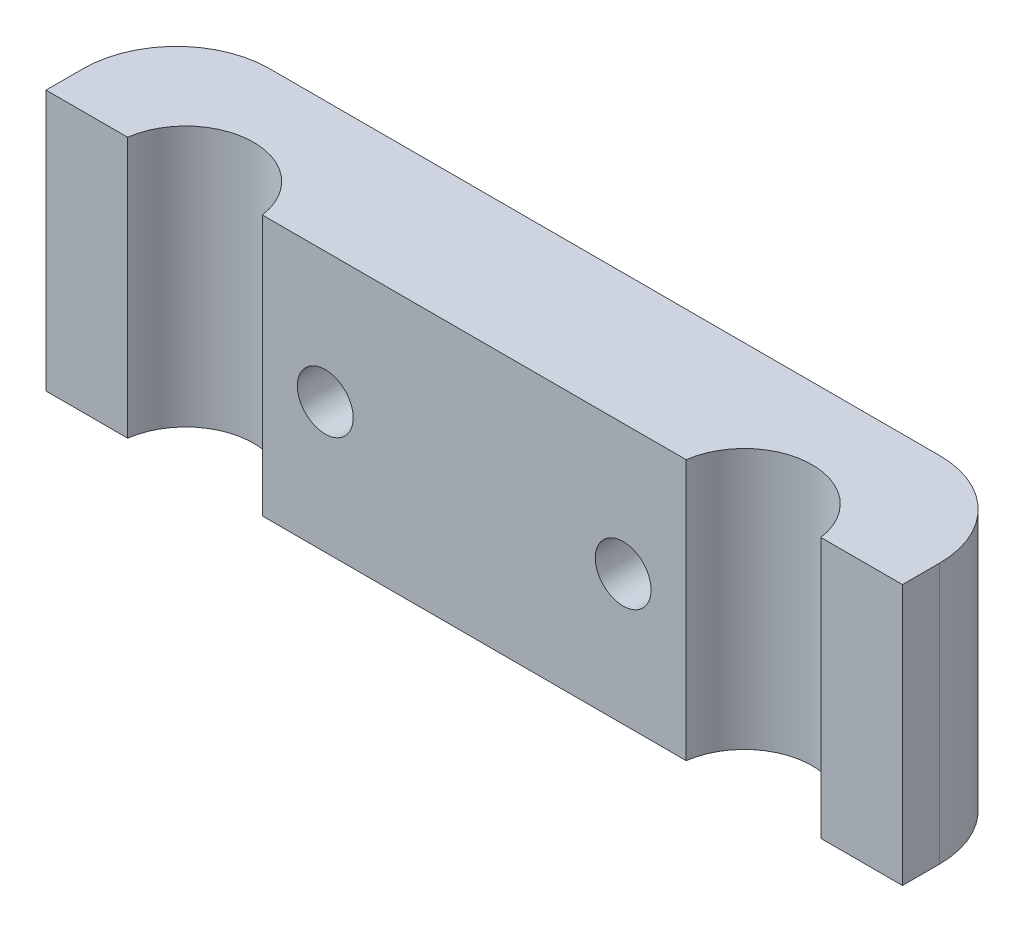
from build123d import *

# Parameters (mm, degrees)
SKETCH_1_W          = 46
SKETCH_1_H          = 14
EXTRUDE_1_DEPTH     = 7
CUT_EXTRUDE_1_REACH = 27.04
SKETCH_2_R          = 1.5
CUT_EXTRUDE_2_REACH = 29.821
SKETCH_3_R          = 3.65
SKETCH_4_R          = 3
CUT_EXTRUDE_3_DEPTH = 3.8
FILLET_1_R          = 5


with BuildPart() as part:
    # Эскиз1 → Бобышка-Вытянуть1 (new body)
    with BuildSketch(Plane.XY):
        Rectangle(SKETCH_1_W, SKETCH_1_H)
    extrude(amount=EXTRUDE_1_DEPTH)

    # Эскиз2 → Вырез-Вытянуть1 (cut, up to next)
    with BuildSketch(Plane.XY.offset(7), mode=Mode.PRIVATE) as cut_extrude_1_sk1:
        with Locations((-8, 0)):
            Circle(SKETCH_2_R)
    cut_extrude_1_tool1 = extrude(cut_extrude_1_sk1.sketch, amount=-CUT_EXTRUDE_1_REACH, mode=Mode.PRIVATE) & part.part
    # Эскиз2 → Вырез-Вытянуть1 (cut, up to next)
    with BuildSketch(Plane.XY.offset(7), mode=Mode.PRIVATE) as cut_extrude_1_sk2:
        with Locations(Location((8, 0, 0), (0, 0, 180))):
            Circle(SKETCH_2_R)
    cut_extrude_1_tool2 = extrude(cut_extrude_1_sk2.sketch, amount=-CUT_EXTRUDE_1_REACH, mode=Mode.PRIVATE) & part.part
    add(cut_extrude_1_tool1.solids().sort_by_distance((-8, 0, 7))[0], mode=Mode.SUBTRACT)
    add(cut_extrude_1_tool2.solids().sort_by_distance((8, 0, 7))[0], mode=Mode.SUBTRACT)

    # Эскиз3 → Вырез-Вытянуть2 (cut, up to next)
    with BuildSketch(Plane(origin=(0, 7, 0), x_dir=(1, 0, 0), z_dir=(0, 1, 0)), mode=Mode.PRIVATE) as cut_extrude_2_sk1:
        with Locations((-15, -7.5)):
            Circle(SKETCH_3_R)
    cut_extrude_2_tool1 = extrude(cut_extrude_2_sk1.sketch, amount=-CUT_EXTRUDE_2_REACH, mode=Mode.PRIVATE) & part.part
    # Эскиз3 → Вырез-Вытянуть2 (cut, up to next)
    with BuildSketch(Plane(origin=(0, 7, 0), x_dir=(1, 0, 0), z_dir=(0, 1, 0)), mode=Mode.PRIVATE) as cut_extrude_2_sk2:
        with Locations((15, -7.5)):
            Circle(SKETCH_3_R)
    cut_extrude_2_tool2 = extrude(cut_extrude_2_sk2.sketch, amount=-CUT_EXTRUDE_2_REACH, mode=Mode.PRIVATE) & part.part
    add(cut_extrude_2_tool1.solids().sort_by_distance((-15, 7, 7.5))[0], mode=Mode.SUBTRACT)
    add(cut_extrude_2_tool2.solids().sort_by_distance((15, 7, 7.5))[0], mode=Mode.SUBTRACT)

    # Эскиз4 → Вырез-Вытянуть3 (cut)
    with BuildSketch(Plane(origin=(0, 0, 0), x_dir=(-1, 0, 0), z_dir=(0, 0, -1))):
        with Locations((-8, 0)):
            Circle(SKETCH_4_R)
        with Locations((8, 0)):
            Circle(SKETCH_4_R)
    extrude(amount=-CUT_EXTRUDE_3_DEPTH, mode=Mode.SUBTRACT)

    # Скругление1
    fillet_1_edges = [part.edges().sort_by_distance(p)[0] for p in [
        (-23, 0, 0),
        (23, 0, 0),
    ]]
    fillet(fillet_1_edges, radius=FILLET_1_R)


solid = part.part
